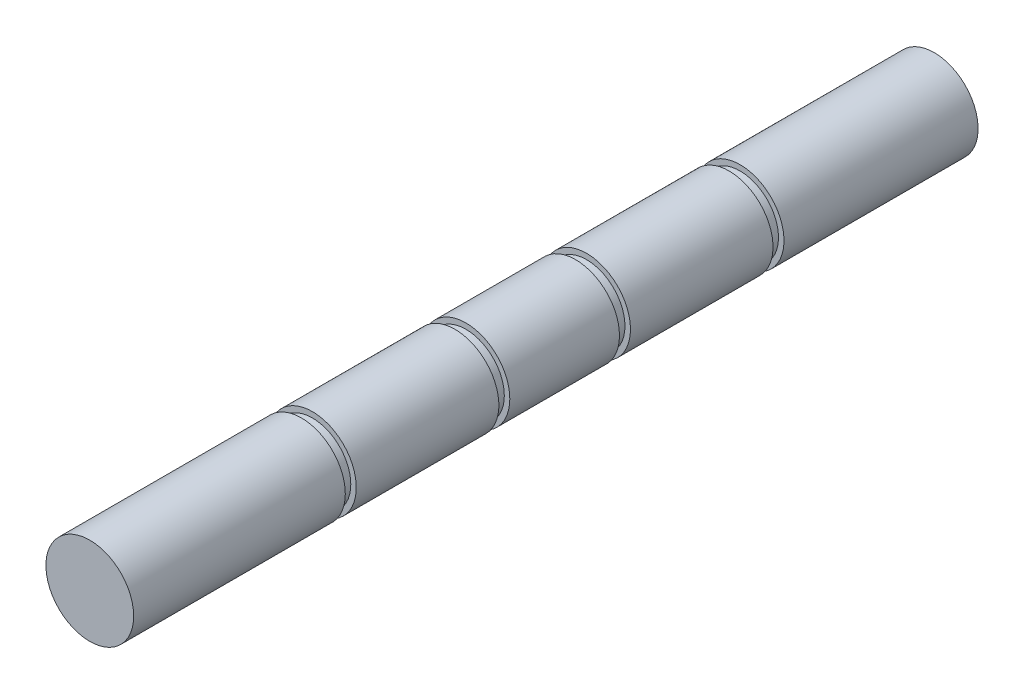
from build123d import *

# Parameters (mm, degrees)
SKETCH1_R           = 3.5
BOSS_EXTRUDE1_DEPTH = 77
SKETCH3_R           = 4
SKETCH3_R_2         = 3.5
BOSS_EXTRUDE2_DEPTH = 17.7
SKETCH6_R           = 4
SKETCH6_R_2         = 3
BOSS_EXTRUDE3_DEPTH = 13
SKETCH7_R           = 4
SKETCH7_R_2         = 3
BOSS_EXTRUDE4_DEPTH = 10
SKETCH8_R           = 4
SKETCH8_R_2         = 3
BOSS_EXTRUDE5_DEPTH = 13
SKETCH9_R           = 4
SKETCH9_R_2         = 3
BOSS_EXTRUDE6_DEPTH = 19.3


with BuildPart() as part:
    # Sketch1 → Boss-Extrude1 (new body)
    with BuildSketch(Plane.XY):
        Circle(SKETCH1_R)
    extrude(amount=BOSS_EXTRUDE1_DEPTH)

    # Sketch3 → Boss-Extrude2 (add)
    with BuildSketch(Plane(origin=(0, 0, 0), x_dir=(-1, 0, 0), z_dir=(0, 0, -1))):
        Circle(SKETCH3_R)
        Circle(SKETCH3_R_2, mode=Mode.SUBTRACT)
    extrude(amount=-BOSS_EXTRUDE2_DEPTH)

    # Sketch6 → Boss-Extrude3 (add)
    with BuildSketch(Plane.XY.offset(18.7)):
        with Locations(Location((0, 0, 0), (0, 0, 180))):
            Circle(SKETCH6_R)
        Circle(SKETCH6_R_2, mode=Mode.SUBTRACT)
    extrude(amount=BOSS_EXTRUDE3_DEPTH)

    # Sketch7 → Boss-Extrude4 (add)
    with BuildSketch(Plane.XY.offset(32.7)):
        with Locations(Location((0, 0, 0), (0, 0, 180))):
            Circle(SKETCH7_R)
        Circle(SKETCH7_R_2, mode=Mode.SUBTRACT)
    extrude(amount=BOSS_EXTRUDE4_DEPTH)

    # Sketch8 → Boss-Extrude5 (add)
    with BuildSketch(Plane.XY.offset(43.7)):
        with Locations(Location((0, 0, 0), (0, 0, 180))):
            Circle(SKETCH8_R)
        Circle(SKETCH8_R_2, mode=Mode.SUBTRACT)
    extrude(amount=BOSS_EXTRUDE5_DEPTH)

    # Sketch9 → Boss-Extrude6 (add)
    with BuildSketch(Plane.XY.offset(57.7)):
        with Locations(Location((0, 0, 0), (0, 0, 180))):
            Circle(SKETCH9_R)
        Circle(SKETCH9_R_2, mode=Mode.SUBTRACT)
    extrude(amount=BOSS_EXTRUDE6_DEPTH)


solid = part.part
